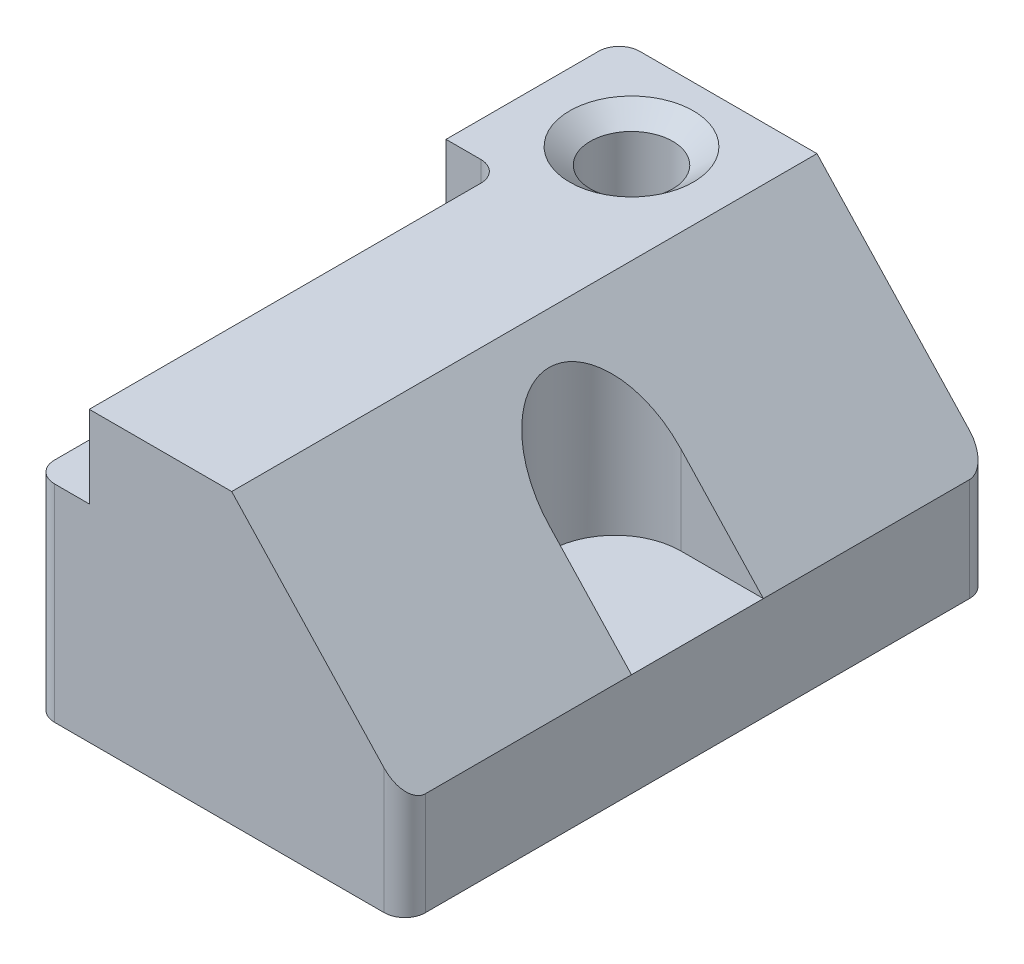
from build123d import *
from OCP.BRepFilletAPI import BRepFilletAPI_MakeChamfer

# Parameters (mm, degrees)
BOSS_EXTRUDE1_DEPTH = 142
SKETCH2_W           = 13.438345352
SKETCH2_H           = 19.890532225
CUT_EXTRUDE1_DEPTH  = 100
SKETCH4_R           = 10
CUT_EXTRUDE2_DEPTH  = 100
CUT_EXTRUDE3_DEPTH  = 100
CHAMFER1_SIZE       = 5
CHAMFER1_SIZE2      = 3.906428133
FILLET5_R           = 5
FILLET6_R           = 5
FILLET7_R           = 5


with BuildPart() as part:
    # Sketch1 → Boss-Extrude1 (new body)
    with BuildSketch(Plane.XY):
        Polygon((-45, -35), (45, -35), (45, -10), (3, 35), (-45, 35), align=None)
    extrude(amount=-BOSS_EXTRUDE1_DEPTH)

    # Sketch2 → Cut-Extrude1 (cut)
    with BuildSketch(Plane.XY):
        with Locations((-38.280827324, 25.054733887)):
            Rectangle(SKETCH2_W, SKETCH2_H)
    extrude(amount=-CUT_EXTRUDE1_DEPTH, mode=Mode.SUBTRACT)

    # Sketch4 → Cut-Extrude2 (cut)
    with BuildSketch(Plane(origin=(0, 35, 0), x_dir=(1, 0, 0), z_dir=(0, 1, 0))):
        with Locations(Location((-21, 121, 0), (0, 0, 180))):
            Circle(SKETCH4_R)
    extrude(amount=-CUT_EXTRUDE2_DEPTH, mode=Mode.SUBTRACT)

    # 3DSketch2 → Cut-Extrude3 (cut)
    with BuildSketch(Plane(origin=(45, -10, -55), x_dir=(-0.5299989400031795, 0, -0.8479983040050884), z_dir=(0, 1, 0))):
        with BuildLine():
            Line((0, 0), (10.5999788, 16.95996608))
            ThreePointArc((10.5999788, 16.95996608), (32.647934704, 22.047955904), (37.735924528, 0))
            Line((37.735924528, 0), (27.135945728, -16.95996608))
            Line((27.135945728, -16.95996608), (0, 0))
        make_face()
    extrude(amount=CUT_EXTRUDE3_DEPTH, mode=Mode.SUBTRACT)

    # Chamfer1: one chamfer whose edges measure the first distance from different faces: ONE call of the kernel's chamfer builder (chamfer() names one face for all edges)
    chamfer1_edges_1 = [part.edges().sort_by_distance(p)[0] for p in [
        (-11, -35, -121),
    ]]
    chamfer1_side_1 = [part.faces().sort_by_distance(p)[0] for p in [
        (0.529233825, -35, -69.739919465),
    ]]
    chamfer1_edges_2 = [part.edges().sort_by_distance(p)[0] for p in [
        (-11, 35, -121),
    ]]
    chamfer1_side_2 = [part.faces().sort_by_distance(p)[0] for p in [
        (-16.497761799, 35, -73.425852449),
    ]]
    chamfer1 = BRepFilletAPI_MakeChamfer(part.part.solid().wrapped)
    for e in chamfer1_edges_1:
        chamfer1.Add(CHAMFER1_SIZE, CHAMFER1_SIZE2, e.wrapped, chamfer1_side_1[0].wrapped)  # the first distance lies on this face
    for e in chamfer1_edges_2:
        chamfer1.Add(CHAMFER1_SIZE, CHAMFER1_SIZE2, e.wrapped, chamfer1_side_2[0].wrapped)  # the first distance lies on this face
    add(Compound.cast(chamfer1.Shape()), mode=Mode.REPLACE)

    # Fillet5
    fillet5_edges = [part.edges().sort_by_distance(p)[0] for p in [
        (-31.561654648, 25.054733887, -100),
    ]]
    fillet(fillet5_edges, radius=FILLET5_R)

    # Fillet6
    fillet6_edges = [part.edges().sort_by_distance(p)[0] for p in [
        (-45, -9.945266113, 0),
        (45, -22.5, 0),
    ]]
    fillet(fillet6_edges, radius=FILLET6_R)

    # Fillet7
    fillet7_edges = [part.edges().sort_by_distance(p)[0] for p in [
        (-45, 0, -142),
        (45, -22.5, -142),
    ]]
    fillet(fillet7_edges, radius=FILLET7_R)


solid = part.part
